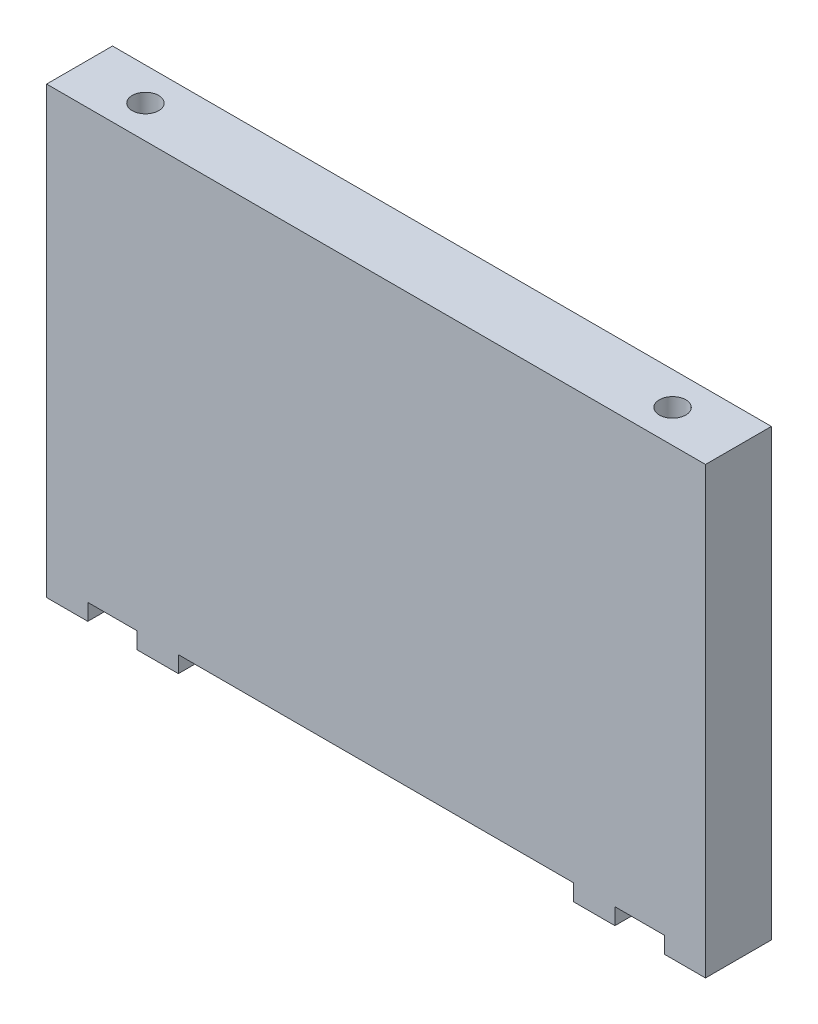
from build123d import *

# Parameters (mm, degrees)
SKETCH1_W                   = 127
SKETCH1_H                   = 85.725
BOSS_EXTRUDE1_DEPTH         = 12.7
SKETCH2_W                   = 76.2
SKETCH2_H                   = 3.175
CUT_EXTRUDE1_DEPTH          = 78.657800035
SKETCH14_W                  = 9.525
SKETCH14_H                  = 3.175
CUT_EXTRUDE2_DEPTH          = 78.657800035
F_1_4_20_TAPPED_HOLE1_D     = 5.1054
F_1_4_20_TAPPED_HOLE1_DEPTH = 16.51
F_1_4_20_TAPPED_HOLE1_TIP   = 1.533816902
F_1_4_20_TAPPED_HOLE2_D     = 5.1054
F_1_4_20_TAPPED_HOLE2_DEPTH = 16.51
F_1_4_20_TAPPED_HOLE2_TIP   = 1.533816902


with BuildPart() as part:
    # Sketch1 → Boss-Extrude1 (new body)
    with BuildSketch(Plane.XY):
        Rectangle(SKETCH1_W, SKETCH1_H)
    extrude(amount=BOSS_EXTRUDE1_DEPTH)

    # Sketch2 → Cut-Extrude1 (cut, through all)
    with BuildSketch(Plane.XY.offset(12.7)):
        with Locations((0, -41.275)):
            Rectangle(SKETCH2_W, SKETCH2_H)
    extrude(amount=-CUT_EXTRUDE1_DEPTH, mode=Mode.SUBTRACT)

    # Sketch14 → Cut-Extrude2 (cut, through all)
    with BuildSketch(Plane.XY.offset(12.7)):
        with Locations((50.8, -41.275)):
            Rectangle(SKETCH14_W, SKETCH14_H)
        with Locations((-50.8, -41.275)):
            Rectangle(SKETCH14_W, SKETCH14_H)
    extrude(amount=-CUT_EXTRUDE2_DEPTH, mode=Mode.SUBTRACT)

    # 1/4-20 Tapped Hole1
    with Locations(Plane(origin=(-50.8, -39.6875, 6.35), x_dir=(-1, 0, 0), z_dir=(0, -1, 0))):
        with Locations((0, 0), (-101.6, 0)):
            Hole(F_1_4_20_TAPPED_HOLE1_D / 2, depth=F_1_4_20_TAPPED_HOLE1_DEPTH)
            with Locations((0, 0, -(F_1_4_20_TAPPED_HOLE1_DEPTH + F_1_4_20_TAPPED_HOLE1_TIP / 2))):  # 118° drill point
                Cone(0, F_1_4_20_TAPPED_HOLE1_D / 2, F_1_4_20_TAPPED_HOLE1_TIP, mode=Mode.SUBTRACT)

    # 1/4-20 Tapped Hole2
    with Locations(Plane(origin=(-50.8, 42.8625, 6.35), x_dir=(0, 0, 1), z_dir=(0, 1, 0))):
        with Locations((0, 0), (0, 101.6)):
            Hole(F_1_4_20_TAPPED_HOLE2_D / 2, depth=F_1_4_20_TAPPED_HOLE2_DEPTH)
            with Locations((0, 0, -(F_1_4_20_TAPPED_HOLE2_DEPTH + F_1_4_20_TAPPED_HOLE2_TIP / 2))):  # 118° drill point
                Cone(0, F_1_4_20_TAPPED_HOLE2_D / 2, F_1_4_20_TAPPED_HOLE2_TIP, mode=Mode.SUBTRACT)


solid = part.part
